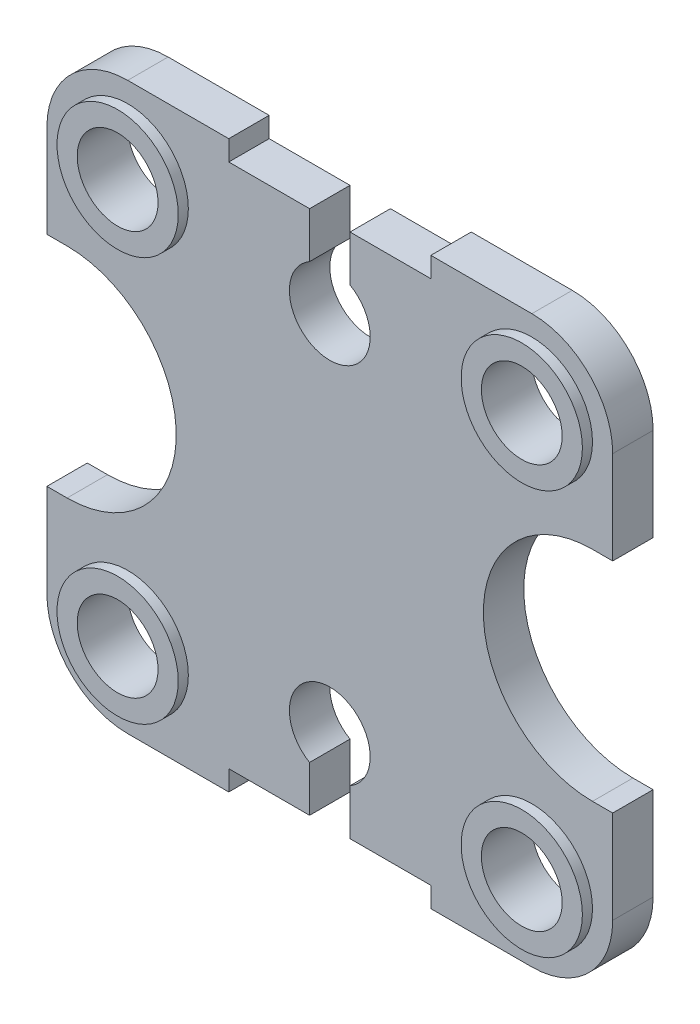
from build123d import *

# Parameters (mm, degrees)
SKETCH2_R           = 30
BOSS_EXTRUDE2_DEPTH = 20
SKETCH2_5_R         = 30
SKETCH2_5_R_2       = 20
BOSS_EXTRUDE3_DEPTH = 25


with BuildPart() as part:
    # Sketch2 → Boss-Extrude2 (new body)
    with BuildSketch(Plane.XY):
        with BuildLine():
            ThreePointArc((-2.644987214, 42.222447728), (9.070741539, 13.938176481), (37.355012786, 2.222447728))
            Line((37.355012786, 2.222447728), (87.355012786, 2.222447728))
            Line((87.355012786, 2.222447728), (87.355012786, 12.222447728))
            Line((87.355012786, 12.222447728), (127.355012786, 12.222447728))
            Line((127.355012786, 12.222447728), (127.355012786, 34.901939653))
            ThreePointArc((127.355012786, 34.901939653), (137.355012786, 72.222447728), (147.355012786, 34.901939653))
            Line((147.355012786, 34.901939653), (147.355012786, 12.222447728))
            Line((147.355012786, 12.222447728), (187.355012786, 12.222447728))
            Line((187.355012786, 12.222447728), (187.355012786, 2.222447728))
            Line((187.355012786, 2.222447728), (237.355012786, 2.222447728))
            ThreePointArc((237.355012786, 2.222447728), (265.639284034, 13.938176481), (277.355012786, 42.222447728))
            Line((277.355012786, 42.222447728), (277.355012786, 88.222447728))
            Line((277.355012786, 88.222447728), (267.355012786, 88.222447728))
            ThreePointArc((267.355012786, 88.222447728), (213.355012786, 142.222447728), (267.355012786, 196.222447728))
            Line((267.355012786, 196.222447728), (277.355012786, 196.222447728))
            Line((277.355012786, 196.222447728), (277.355012786, 242.222447728))
            ThreePointArc((277.355012786, 242.222447728), (265.639284034, 270.506718976), (237.355012786, 282.222447728))
            Line((237.355012786, 282.222447728), (187.355012786, 282.222447728))
            Line((187.355012786, 282.222447728), (187.355012786, 272.222447728))
            Line((187.355012786, 272.222447728), (147.355012786, 272.222447728))
            Line((147.355012786, 272.222447728), (147.355012786, 249.542955804))
            ThreePointArc((147.355012786, 249.542955804), (137.355012786, 212.222447728), (127.355012786, 249.542955804))
            Line((127.355012786, 249.542955804), (127.355012786, 272.222447728))
            Line((127.355012786, 272.222447728), (87.355012786, 272.222447728))
            Line((87.355012786, 272.222447728), (87.355012786, 282.222447728))
            Line((87.355012786, 282.222447728), (37.355012786, 282.222447728))
            ThreePointArc((37.355012786, 282.222447728), (9.070741539, 270.506718976), (-2.644987214, 242.222447728))
            Line((-2.644987214, 242.222447728), (-2.644987214, 196.222447728))
            Line((-2.644987214, 196.222447728), (7.355012786, 196.222447728))
            ThreePointArc((7.355012786, 196.222447728), (61.355012786, 142.222447728), (7.355012786, 88.222447728))
            Line((7.355012786, 88.222447728), (-2.644987214, 88.222447728))
            Line((-2.644987214, 88.222447728), (-2.644987214, 42.222447728))
        make_face()
        with Locations((37.355012786, 42.222447728)):
            Circle(SKETCH2_R, mode=Mode.SUBTRACT)
        with Locations((237.355012786, 42.222447728)):
            Circle(SKETCH2_R, mode=Mode.SUBTRACT)
        with Locations((37.355012786, 242.222447728)):
            Circle(SKETCH2_R, mode=Mode.SUBTRACT)
        with Locations((237.355012786, 242.222447728)):
            Circle(SKETCH2_R, mode=Mode.SUBTRACT)
    extrude(amount=BOSS_EXTRUDE2_DEPTH)

    # Sketch2<5> → Boss-Extrude3 (add)
    # profile 1 of 4: a face of its own
    with BuildSketch(Plane.XY):
        with Locations((37.355012786, 242.222447728)):
            Circle(SKETCH2_5_R)
        with Locations((37.355012786, 242.222447728)):
            Circle(SKETCH2_5_R_2, mode=Mode.SUBTRACT)
    # profile 2 of 4: a face of its own
    with BuildSketch(Plane.XY):
        with Locations((37.355012786, 42.222447728)):
            Circle(SKETCH2_5_R)
        with Locations((37.355012786, 42.222447728)):
            Circle(SKETCH2_5_R_2, mode=Mode.SUBTRACT)
    # profile 3 of 4: a face of its own
    with BuildSketch(Plane.XY):
        with Locations((237.355012786, 42.222447728)):
            Circle(SKETCH2_5_R)
        with Locations((237.355012786, 42.222447728)):
            Circle(SKETCH2_5_R_2, mode=Mode.SUBTRACT)
    # profile 4 of 4: a face of its own
    with BuildSketch(Plane.XY):
        with Locations((237.355012786, 242.222447728)):
            Circle(SKETCH2_5_R)
        with Locations((237.355012786, 242.222447728)):
            Circle(SKETCH2_5_R_2, mode=Mode.SUBTRACT)
    extrude(amount=BOSS_EXTRUDE3_DEPTH)


solid = part.part
